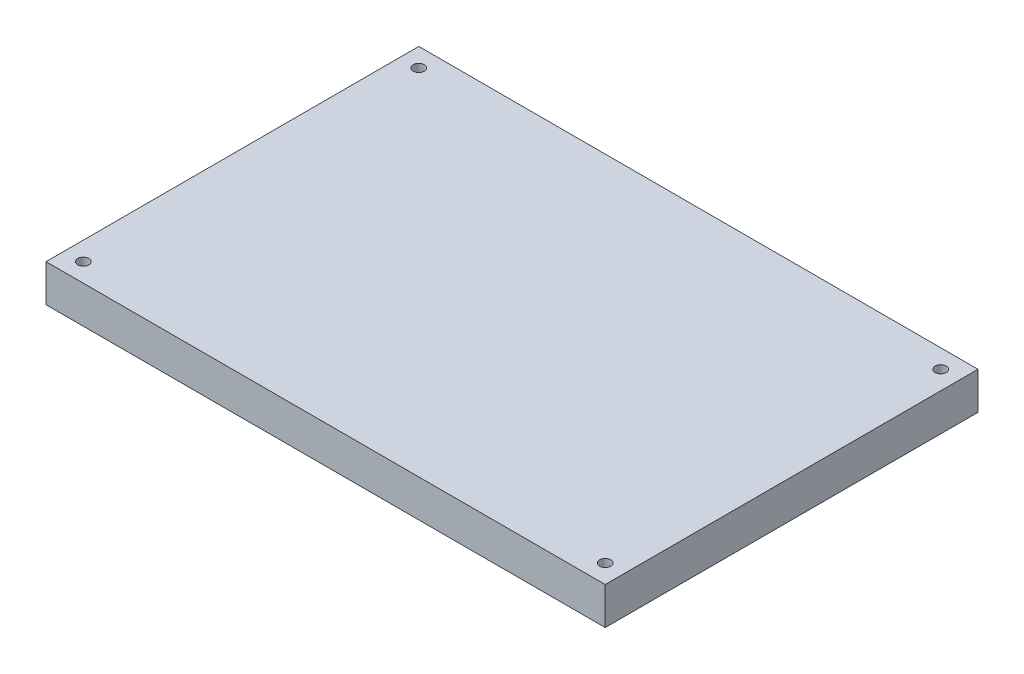
from build123d import *

# Parameters (mm, degrees)
SKETCH1_W           = 300
SKETCH1_H           = 200
BOSS_EXTRUDE2_DEPTH = 20
SKETCH8_R           = 3
CUT_EXTRUDE14_DEPTH = 20
SKETCH10_R          = 3
CUT_EXTRUDE16_DEPTH = 20
SKETCH11_R          = 3
CUT_EXTRUDE17_DEPTH = 20


with BuildPart() as part:
    # Sketch1 → Boss-Extrude2 (new body)
    with BuildSketch(Plane(origin=(0, 0, 0), x_dir=(1, 0, 0), z_dir=(0, 1, 0))):
        with Locations((150, 100)):
            Rectangle(SKETCH1_W, SKETCH1_H)
    extrude(amount=BOSS_EXTRUDE2_DEPTH)

    # Sketch8 → Cut-Extrude14 (cut)
    with BuildSketch(Plane(origin=(0, 20, 0), x_dir=(1, 0, 0), z_dir=(0, 1, 0))):
        with Locations(Location((10, 190, 0), (0, 0, 270))):
            Circle(SKETCH8_R)
    extrude(amount=-CUT_EXTRUDE14_DEPTH, mode=Mode.SUBTRACT)

    # Sketch10 → Cut-Extrude16 (cut)
    with BuildSketch(Plane(origin=(0, 20, 0), x_dir=(1, 0, 0), z_dir=(0, 1, 0))):
        with Locations(Location((10, 10, 0), (0, 0, 270))):
            Circle(SKETCH10_R)
    extrude(amount=-CUT_EXTRUDE16_DEPTH, mode=Mode.SUBTRACT)

    # Sketch11 → Cut-Extrude17 (cut)
    with BuildSketch(Plane(origin=(0, 20, 0), x_dir=(1, 0, 0), z_dir=(0, 1, 0))):
        with Locations(Location((290, 190, 0), (0, 0, 270))):
            Circle(SKETCH11_R)
        with Locations(Location((290, 10, 0), (0, 0, 270))):
            Circle(SKETCH11_R)
    extrude(amount=-CUT_EXTRUDE17_DEPTH, mode=Mode.SUBTRACT)


solid = part.part
